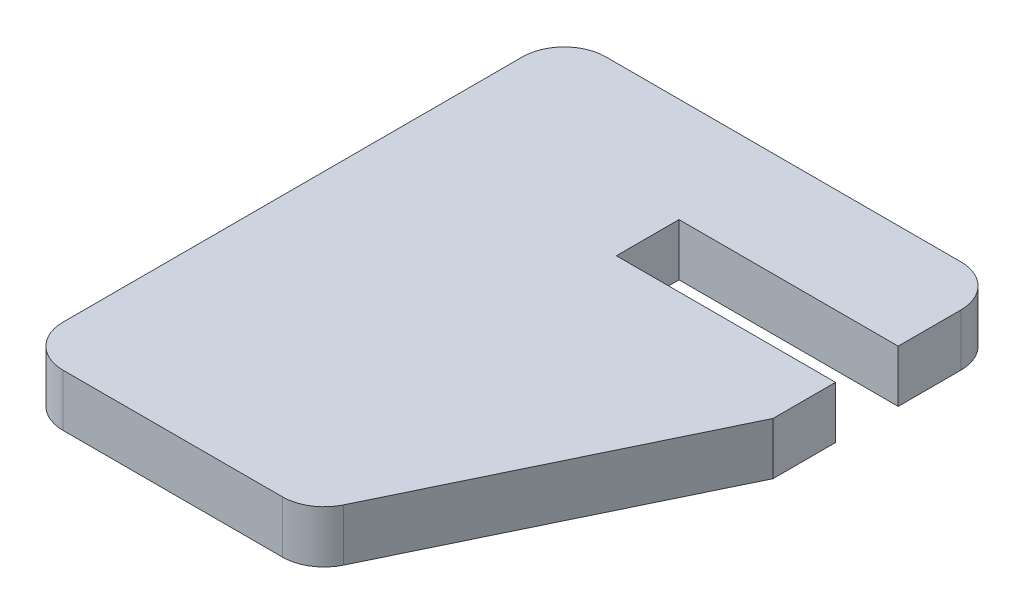
from build123d import *

# Parameters (mm, degrees)
BOSS_EXTRUDE1_DEPTH = 6.35


with BuildPart() as part:
    # Sketch1 → Boss-Extrude1 (new body)
    with BuildSketch(Plane(origin=(0, 0, 0), x_dir=(1, 0, 0), z_dir=(0, 1, 0))):
        with BuildLine():
            Line((26.67, 7.62), (26.67, 15.24))
            ThreePointArc((26.67, 15.24), (25.182102448, 18.832102448), (21.59, 20.32))
            Line((21.59, 20.32), (-21.59, 20.32))
            ThreePointArc((-21.59, 20.32), (-25.182102448, 18.832102448), (-26.67, 15.24))
            Line((-26.67, 15.24), (-26.67, -40.64))
            ThreePointArc((-26.67, -40.64), (-25.182102448, -44.232102448), (-21.59, -45.72))
            Line((-21.59, -45.72), (5.08, -45.72))
            ThreePointArc((5.08, -45.72), (7.780244368, -44.942915332), (9.654379091, -42.849401713))
            Line((9.654379091, -42.849401713), (26.67, -7.62))
            Line((26.67, -7.62), (26.67, 0))
            Line((26.67, 0), (0, 0))
            Line((0, 0), (0, 7.62))
            Line((0, 7.62), (26.67, 7.62))
        make_face()
    extrude(amount=BOSS_EXTRUDE1_DEPTH)


solid = part.part
